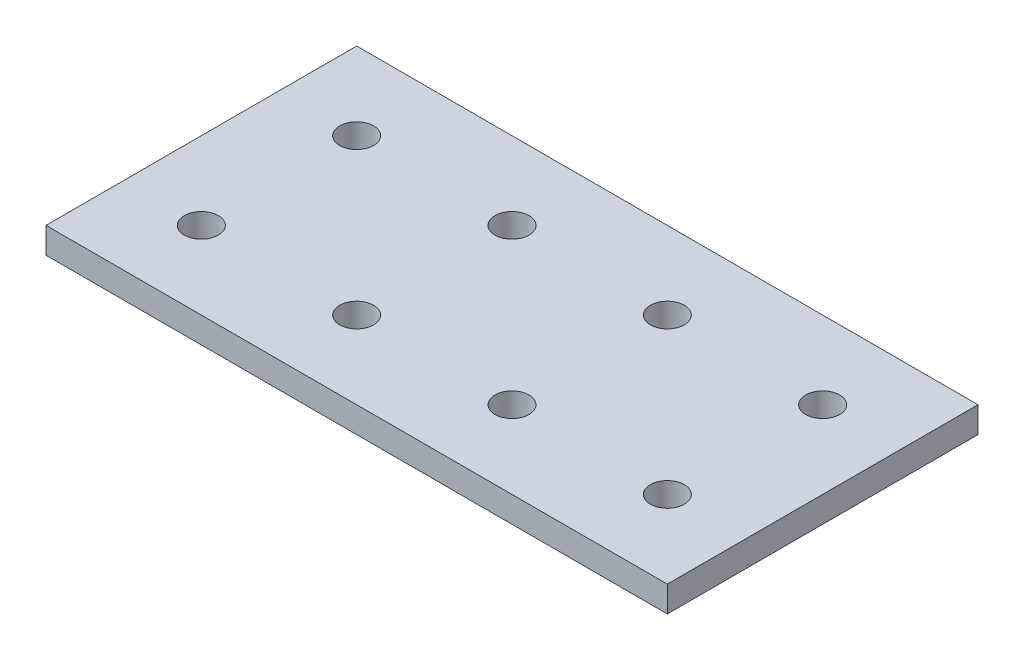
from build123d import *

# Parameters (mm, degrees)
SKETCH1_W                        = 152.4
SKETCH1_H                        = 76.2
BOSS_EXTRUDE1_DEPTH              = 6.35
F_21_64_0_32813_DIAMETER_HOLE1_D = 8.334502
LPATTERN1_COUNT                  = 2
LPATTERN1_PITCH                  = 38.1
LPATTERN1_COUNT_DIR2             = 4
LPATTERN1_PITCH_DIR2             = 38.1


with BuildPart() as part:
    # Sketch1 → Boss-Extrude1 (new body)
    with BuildSketch(Plane(origin=(0, 0, 0), x_dir=(1, 0, 0), z_dir=(0, 1, 0))):
        with Locations((76.2, 38.1)):
            Rectangle(SKETCH1_W, SKETCH1_H)
    extrude(amount=BOSS_EXTRUDE1_DEPTH)

    # 21/64 (0.32813) Diameter Hole1 (through all)
    with Locations(Plane(origin=(0, 6.35, 0), x_dir=(1, 0, 0), z_dir=(0, 1, 0))):
        with Locations((19.05, 57.15)):
            f_21_64_0_32813_diameter_hole1 = Hole(F_21_64_0_32813_DIAMETER_HOLE1_D / 2)

    # LPattern1: 21_64 _0.32813_ Diameter Hole1 2 × 4
    with Locations(*[(j * LPATTERN1_PITCH_DIR2, 0, i * LPATTERN1_PITCH) for i in range(LPATTERN1_COUNT) for j in range(LPATTERN1_COUNT_DIR2) if (i, j) != (0, 0)]):
        add(f_21_64_0_32813_diameter_hole1, mode=Mode.SUBTRACT)


solid = part.part
